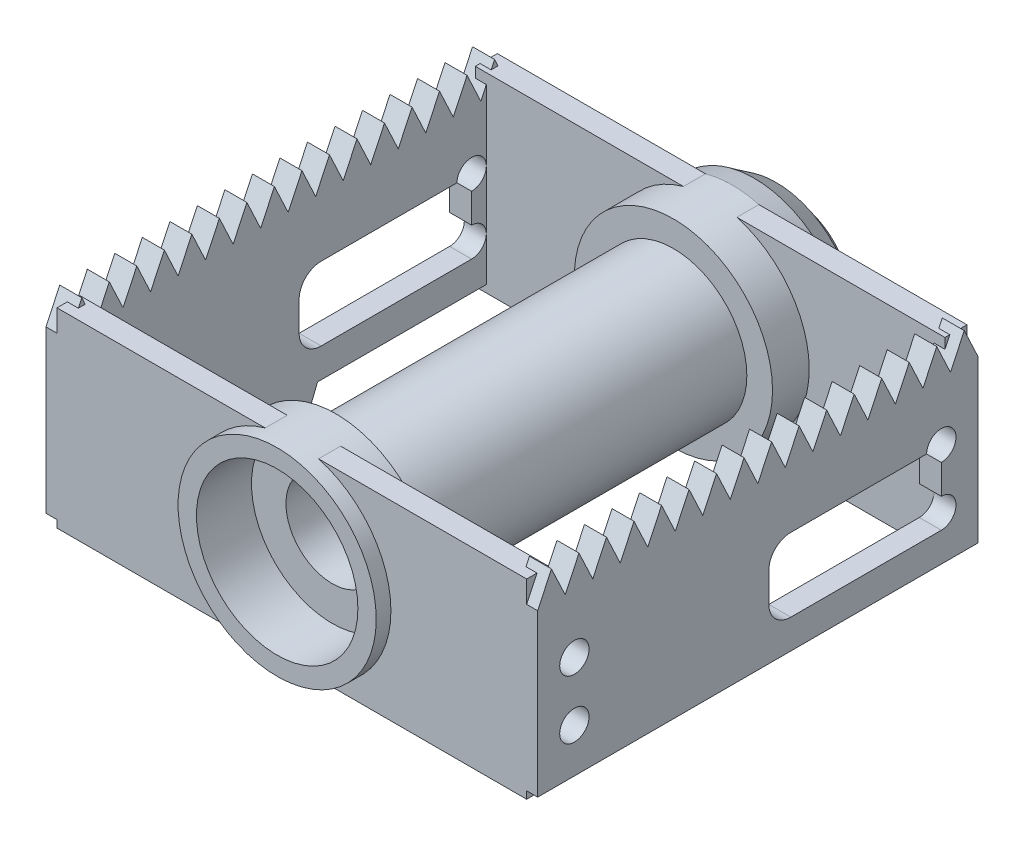
from build123d import *

# Parameters (mm, degrees)
PLACA_DELANTERA_START               = -206
PLACA_DELANTERA_DEPTH               = 3
AGUJERO_PLACA_DELANTERA_1_PROFILE_R = 2
AGUJERO_PLACA_DELANTERA_2_PROFILE_R = 2
AGUJERO_PLACA_DELANTERA_3_PROFILE_R = 2
AGUJERO_PLACA_DELANTERA_4_PROFILE_R = 2
PLACA_TRASERA_START                 = -142
PLACA_TRASERA_DEPTH                 = 3
AGUJERO_PLACA_TRASERA_1_PROFILE_R   = 2
AGUJERO_PLACA_TRASERA_2_PROFILE_R   = 2
AGUJERO_PLACA_TRASERA_3_PROFILE_R   = 2
AGUJERO_PLACA_TRASERA_4_PROFILE_R   = 2
MARCO_INTERIOR_START                = -86
SK_MARCO_INTERIOR_W                 = 64
SK_MARCO_INTERIOR_H                 = 26
SK_MARCO_INTERIOR_R                 = 11
MARCO_INTERIOR_DEPTH                = 3
MARCO_EXTERIOR_START                = -143
SK_MARCO_EXTERIOR_W                 = 64
SK_MARCO_EXTERIOR_H                 = 26
SK_MARCO_EXTERIOR_R                 = 11
MARCO_EXTERIOR_DEPTH                = 3
CORTAR_EXTRUIR2_DEPTH               = 10


with BuildPart() as part:
    # Sk_Eje_cuerpo → Eje_cuerpo (revolve)
    with BuildSketch(Plane(origin=(0, 0, 0), x_dir=(1, 0, 0), z_dir=(0, 1, 0))):
        Polygon((-183.5, 84), (-186, 84), (-186, 92), (-182.5, 92), (-182.5, 138), (-186, 138), (-186, 146), (-185.3, 149), (-183.3, 152), (-180, 154.5), (-176.5, 155.7), (-172.5, 156), (-172.5, 147), (-183.5, 147), (-183.5, 138.5), (-178.8, 138.5), (-178.8, 91.5), (-183.5, 91.5), align=None)
    revolve(axis=Axis((-172.5, 0, -62.1), (0, 0, -1)))



with BuildPart() as body_2:
    # Sk_Placa_delantera → Placa_delantera (new body)
    with BuildSketch(Plane(origin=(0, 0, 0), x_dir=(0, 0, -1), z_dir=(1, 0, 0)).offset(PLACA_DELANTERA_START)):
        Polygon((86, -12), (112, -12), (116, -22), (120, -12), (146, -12), (146, 10), (144.125, 14), (142.25, 10), (140.375, 14), (138.5, 10), (136.625, 14), (134.75, 10), (132.875, 14), (131, 10), (129.125, 14), (127.25, 10), (125.375, 14), (123.5, 10), (121.625, 14), (119.75, 10), (117.875, 14), (116, 10), (114.125, 14), (112.25, 10), (110.375, 14), (108.5, 10), (106.625, 14), (104.75, 10), (102.875, 14), (101, 10), (99.125, 14), (97.25, 10), (95.375, 14), (93.5, 10), (91.625, 14), (89.75, 10), (87.875, 14), (86, 10), align=None)
    extrude(amount=PLACA_DELANTERA_DEPTH)

    # Agujero_Placa_delantera_1: sweep along a curve in space
    with BuildLine() as agujero_placa_delantera_1_path:
        Line((-201.5, -6, -91), (-207.5, -6, -91))
    # Agujero_Placa_delantera_1 profile (on start of the path) → Agujero_Placa_delantera_1 (sweep, cut)
    with BuildSketch(Plane(origin=(-201.5, -6, -91), x_dir=(0, 0, -1), z_dir=(-1, 0, 0))):
        Circle(AGUJERO_PLACA_DELANTERA_1_PROFILE_R)
    sweep(path=agujero_placa_delantera_1_path.line, mode=Mode.SUBTRACT)

    # Agujero_Placa_delantera_2: sweep along a curve in space
    with BuildLine() as agujero_placa_delantera_2_path:
        Line((-201.5, 2, -91), (-207.5, 2, -91))
    # Agujero_Placa_delantera_2 profile (on start of the path) → Agujero_Placa_delantera_2 (sweep, cut)
    with BuildSketch(Plane(origin=(-201.5, 2, -91), x_dir=(0, 0, -1), z_dir=(-1, 0, 0))):
        Circle(AGUJERO_PLACA_DELANTERA_2_PROFILE_R)
    sweep(path=agujero_placa_delantera_2_path.line, mode=Mode.SUBTRACT)

    # Agujero_Placa_delantera_3: sweep along a curve in space
    with BuildLine() as agujero_placa_delantera_3_path:
        Line((-201.5, -6, -141), (-207.5, -6, -141))
    # Agujero_Placa_delantera_3 profile (on start of the path) → Agujero_Placa_delantera_3 (sweep, cut)
    with BuildSketch(Plane(origin=(-201.5, -6, -141), x_dir=(0, 0, -1), z_dir=(-1, 0, 0))):
        Circle(AGUJERO_PLACA_DELANTERA_3_PROFILE_R)
    sweep(path=agujero_placa_delantera_3_path.line, mode=Mode.SUBTRACT)

    # Agujero_Placa_delantera_4: sweep along a curve in space
    with BuildLine() as agujero_placa_delantera_4_path:
        Line((-201.5, 2, -141), (-207.5, 2, -141))
    # Agujero_Placa_delantera_4 profile (on start of the path) → Agujero_Placa_delantera_4 (sweep, cut)
    with BuildSketch(Plane(origin=(-201.5, 2, -141), x_dir=(0, 0, -1), z_dir=(-1, 0, 0))):
        Circle(AGUJERO_PLACA_DELANTERA_4_PROFILE_R)
    sweep(path=agujero_placa_delantera_4_path.line, mode=Mode.SUBTRACT)


with BuildPart() as body_3:
    # Sk_Placa_trasera → Placa_trasera (new body)
    with BuildSketch(Plane(origin=(0, 0, 0), x_dir=(0, 0, -1), z_dir=(1, 0, 0)).offset(PLACA_TRASERA_START)):
        Polygon((86, -12), (146, -12), (146, 10), (144.125, 14), (142.25, 10), (140.375, 14), (138.5, 10), (136.625, 14), (134.75, 10), (132.875, 14), (131, 10), (129.125, 14), (127.25, 10), (125.375, 14), (123.5, 10), (121.625, 14), (119.75, 10), (117.875, 14), (116, 10), (114.125, 14), (112.25, 10), (110.375, 14), (108.5, 10), (106.625, 14), (104.75, 10), (102.875, 14), (101, 10), (99.125, 14), (97.25, 10), (95.375, 14), (93.5, 10), (91.625, 14), (89.75, 10), (87.875, 14), (86, 10), align=None)
    extrude(amount=PLACA_TRASERA_DEPTH)

    # Agujero_Placa_trasera_1: sweep along a curve in space
    with BuildLine() as agujero_placa_trasera_1_path:
        Line((-137.5, -6, -91), (-143.5, -6, -91))
    # Agujero_Placa_trasera_1 profile (on start of the path) → Agujero_Placa_trasera_1 (sweep, cut)
    with BuildSketch(Plane(origin=(-137.5, -6, -91), x_dir=(0, 0, -1), z_dir=(-1, 0, 0))):
        Circle(AGUJERO_PLACA_TRASERA_1_PROFILE_R)
    sweep(path=agujero_placa_trasera_1_path.line, mode=Mode.SUBTRACT)

    # Agujero_Placa_trasera_2: sweep along a curve in space
    with BuildLine() as agujero_placa_trasera_2_path:
        Line((-137.5, 2, -91), (-143.5, 2, -91))
    # Agujero_Placa_trasera_2 profile (on start of the path) → Agujero_Placa_trasera_2 (sweep, cut)
    with BuildSketch(Plane(origin=(-137.5, 2, -91), x_dir=(0, 0, -1), z_dir=(-1, 0, 0))):
        Circle(AGUJERO_PLACA_TRASERA_2_PROFILE_R)
    sweep(path=agujero_placa_trasera_2_path.line, mode=Mode.SUBTRACT)

    # Agujero_Placa_trasera_3: sweep along a curve in space
    with BuildLine() as agujero_placa_trasera_3_path:
        Line((-137.5, -6, -141), (-143.5, -6, -141))
    # Agujero_Placa_trasera_3 profile (on start of the path) → Agujero_Placa_trasera_3 (sweep, cut)
    with BuildSketch(Plane(origin=(-137.5, -6, -141), x_dir=(0, 0, -1), z_dir=(-1, 0, 0))):
        Circle(AGUJERO_PLACA_TRASERA_3_PROFILE_R)
    sweep(path=agujero_placa_trasera_3_path.line, mode=Mode.SUBTRACT)

    # Agujero_Placa_trasera_4: sweep along a curve in space
    with BuildLine() as agujero_placa_trasera_4_path:
        Line((-137.5, 2, -141), (-143.5, 2, -141))
    # Agujero_Placa_trasera_4 profile (on start of the path) → Agujero_Placa_trasera_4 (sweep, cut)
    with BuildSketch(Plane(origin=(-137.5, 2, -141), x_dir=(0, 0, -1), z_dir=(-1, 0, 0))):
        Circle(AGUJERO_PLACA_TRASERA_4_PROFILE_R)
    sweep(path=agujero_placa_trasera_4_path.line, mode=Mode.SUBTRACT)


with BuildPart() as part_1:
    add(part.part)

    add(body_2.part)  # Marco_interior merges body 2

    add(body_3.part)  # Marco_interior merges body 3
    # Sk_Marco_interior → Marco_interior (add)
    with BuildSketch(Plane.XY.offset(MARCO_INTERIOR_START)):
        with Locations((-172.5, 0)):
            Rectangle(SK_MARCO_INTERIOR_W, SK_MARCO_INTERIOR_H)
        with Locations((-172.5, 0)):
            Circle(SK_MARCO_INTERIOR_R, mode=Mode.SUBTRACT)
    extrude(amount=-MARCO_INTERIOR_DEPTH)

    # Sk_Marco_exterior → Marco_exterior (add)
    with BuildSketch(Plane.XY.offset(MARCO_EXTERIOR_START)):
        with Locations((-172.5, 0)):
            Rectangle(SK_MARCO_EXTERIOR_W, SK_MARCO_EXTERIOR_H)
        with Locations((-172.5, 0)):
            Circle(SK_MARCO_EXTERIOR_R, mode=Mode.SUBTRACT)
    extrude(amount=-MARCO_EXTERIOR_DEPTH)

    # Croquis1 → Cortar-Extruir2 (cut)
    with BuildSketch(Plane(origin=(-139, 0, 0), x_dir=(0, 0, -1), z_dir=(1, 0, 0))):
        with BuildLine():
            Line((117.492022853, -1), (117.492022853, -5))
            ThreePointArc((117.492022853, -5), (118.370702509, -7.121320344), (120.492022853, -8))
            Line((120.492022853, -8), (141, -8))
            Line((141, -8), (141, 2))
            Line((141, 2), (120.492022853, 2))
            ThreePointArc((120.492022853, 2), (118.370702509, 1.121320344), (117.492022853, -1))
        make_face()
    cortar_extruir2 = extrude(amount=-CORTAR_EXTRUIR2_DEPTH, mode=Mode.SUBTRACT)

    # Simetría1: Cortar-Extruir2 across plane
    add(cortar_extruir2.mirror(Plane(origin=(-173, 0, 0), x_dir=(0, 0, 1), z_dir=(1, 0, 0))), mode=Mode.SUBTRACT)


solid = part_1.part
